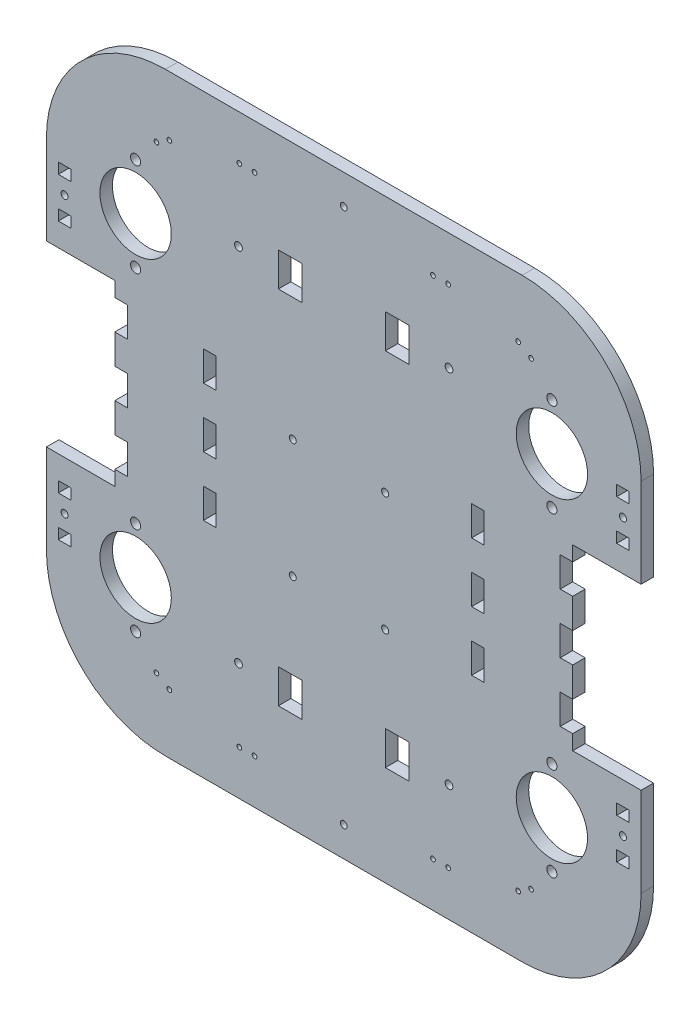
from build123d import *

# Parameters (mm, degrees)
BOSS_EXTRUDE1_DEPTH = 5.334
SKETCH3_W           = 5.334
SKETCH3_H           = 12.7
CUT_EXTRUDE1_DEPTH  = 5.334
SKETCH4_R           = 1.5
CUT_EXTRUDE2_DEPTH  = 360.249845589
SKETCH5_R           = 1.651
SKETCH5_W           = 10.16
SKETCH5_H           = 14.478
CUT_EXTRUDE3_DEPTH  = 360.249845589
SKETCH6_R           = 1.5
SKETCH6_W           = 5.334
SKETCH6_H           = 4.572
CUT_EXTRUDE4_DEPTH  = 360.249845589
SKETCH7_R           = 1
SKETCH7_R_2         = 1.45
CUT_EXTRUDE5_DEPTH  = 360.249845589
SKETCH8_R           = 15.24
SKETCH8_R_2         = 2.159
CUT_EXTRUDE6_DEPTH  = 360.249845589


with BuildPart() as part:
    # Sketch1 → Boss-Extrude1 (new body)
    with BuildSketch(Plane.XY):
        with BuildLine():
            Line((50.8, 0), (203.2, 0))
            ThreePointArc((203.2, 0), (239.121024484, 14.878975516), (254, 50.8))
            Line((254, 50.8), (254, 203.2))
            ThreePointArc((254, 203.2), (239.121024484, 239.121024484), (203.2, 254))
            Line((203.2, 254), (50.8, 254))
            ThreePointArc((50.8, 254), (14.878975516, 239.121024484), (0, 203.2))
            Line((0, 203.2), (0, 50.8))
            ThreePointArc((0, 50.8), (14.878975516, 14.878975516), (50.8, 0))
        make_face()
    extrude(amount=BOSS_EXTRUDE1_DEPTH)

    # Sketch3 → Cut-Extrude1 (cut)
    with BuildSketch(Plane.XY.offset(5.334)):
        Polygon((29.21, 95.25), (29.21, 88.9), (0, 88.9), (0, 165.1), (29.21, 165.1), (29.21, 158.75), (34.544, 158.75), (34.544, 146.05), (29.21, 146.05), (29.21, 133.35), (34.544, 133.35), (34.544, 120.65), (29.21, 120.65), (29.21, 107.95), (34.544, 107.95), (34.544, 95.25), align=None)
        Polygon((224.79, 133.35), (219.456, 133.35), (219.456, 120.65), (224.79, 120.65), (224.79, 107.95), (219.456, 107.95), (219.456, 95.25), (224.79, 95.25), (224.79, 88.9), (254, 88.9), (254, 165.1), (224.79, 165.1), (224.79, 158.75), (219.456, 158.75), (219.456, 146.05), (224.79, 146.05), align=None)
        with Locations((69.723, 127)):
            Rectangle(SKETCH3_W, SKETCH3_H)
        with Locations((69.723, 152.4)):
            Rectangle(SKETCH3_W, SKETCH3_H)
        with Locations((69.723, 101.6)):
            Rectangle(SKETCH3_W, SKETCH3_H)
        with Locations((184.277, 152.4)):
            Rectangle(SKETCH3_W, SKETCH3_H)
        with Locations((184.277, 127)):
            Rectangle(SKETCH3_W, SKETCH3_H)
        with Locations((184.277, 101.6)):
            Rectangle(SKETCH3_W, SKETCH3_H)
    extrude(amount=-CUT_EXTRUDE1_DEPTH, mode=Mode.SUBTRACT)

    # Sketch4 → Cut-Extrude2 (cut, through all)
    with BuildSketch(Plane.XY.offset(5.334)):
        with Locations((105.213395979, 93.678)):
            Circle(SKETCH4_R)
        with Locations(Location((144.679395979, 93.678, 0), (0, 0, 180))):
            Circle(SKETCH4_R)
        with Locations((144.679395979, 144.32)):
            Circle(SKETCH4_R)
        with Locations(Location((105.213395979, 144.32, 0), (0, 0, 180))):
            Circle(SKETCH4_R)
    extrude(amount=-CUT_EXTRUDE2_DEPTH, mode=Mode.SUBTRACT)

    # Sketch5 → Cut-Extrude3 (cut, through all)
    with BuildSketch(Plane.XY.offset(5.334)):
        with Locations((82.042, 204.089)):
            Circle(SKETCH5_R)
        with Locations((104.14, 204.089)):
            Rectangle(SKETCH5_W, SKETCH5_H)
        with Locations((149.86, 204.089)):
            Rectangle(SKETCH5_W, SKETCH5_H)
        with Locations((171.958, 204.089)):
            Circle(SKETCH5_R)
        with Locations((82.042, 49.911)):
            Circle(SKETCH5_R)
        with Locations((104.14, 49.911)):
            Rectangle(SKETCH5_W, SKETCH5_H)
        with Locations((149.86, 49.911)):
            Rectangle(SKETCH5_W, SKETCH5_H)
        with Locations(Location((171.958, 49.911, 0), (0, 0, 180))):
            Circle(SKETCH5_R)
    extrude(amount=-CUT_EXTRUDE3_DEPTH, mode=Mode.SUBTRACT)

    # Sketch6 → Cut-Extrude4 (cut, through all)
    with BuildSketch(Plane.XY.offset(5.334)):
        with Locations((7.747, 185.928)):
            Circle(SKETCH6_R)
        with Locations(Location((246.253, 185.928, 0), (0, 0, 180))):
            Circle(SKETCH6_R)
        with Locations((246.253, 68.072)):
            Circle(SKETCH6_R)
        with Locations(Location((7.747, 68.072, 0), (0, 0, 180))):
            Circle(SKETCH6_R)
        with Locations((7.747, 194.564)):
            Rectangle(SKETCH6_W, SKETCH6_H)
        with Locations((7.747, 177.292)):
            Rectangle(SKETCH6_W, SKETCH6_H)
        with Locations((246.253, 177.292)):
            Rectangle(SKETCH6_W, SKETCH6_H)
        with Locations((246.253, 194.564)):
            Rectangle(SKETCH6_W, SKETCH6_H)
        with Locations((246.253, 59.436)):
            Rectangle(SKETCH6_W, SKETCH6_H)
        with Locations((246.253, 76.708)):
            Rectangle(SKETCH6_W, SKETCH6_H)
        with Locations((7.747, 76.708)):
            Rectangle(SKETCH6_W, SKETCH6_H)
        with Locations((7.747, 59.436)):
            Rectangle(SKETCH6_W, SKETCH6_H)
    extrude(amount=-CUT_EXTRUDE4_DEPTH, mode=Mode.SUBTRACT)

    # Sketch7 → Cut-Extrude5 (cut, through all)
    with BuildSketch(Plane.XY.offset(5.334)):
        with Locations((82.4, 19.05)):
            Circle(SKETCH7_R)
        with Locations((88.9, 19.05)):
            Circle(SKETCH7_R)
        with Locations(Location((165.1, 19.05, 0), (0, 0, 180))):
            Circle(SKETCH7_R)
        with Locations(Location((171.6, 19.05, 0), (0, 0, 180))):
            Circle(SKETCH7_R)
        with Locations((171.6, 234.95)):
            Circle(SKETCH7_R)
        with Locations((165.1, 234.95)):
            Circle(SKETCH7_R)
        with Locations(Location((88.9, 234.95, 0), (0, 0, 180))):
            Circle(SKETCH7_R)
        with Locations(Location((82.4, 234.95, 0), (0, 0, 180))):
            Circle(SKETCH7_R)
        with Locations((127, 12.7)):
            Circle(SKETCH7_R_2)
        with Locations(Location((127, 241.3, 0), (0, 0, 180))):
            Circle(SKETCH7_R_2)
        with Locations((52.518273092, 25.4)):
            Circle(SKETCH7_R)
        with Locations((46.99, 28.818800465)):
            Circle(SKETCH7_R)
        with Locations(Location((207.01, 28.818800465, 0), (0, 0, 180))):
            Circle(SKETCH7_R)
        with Locations(Location((201.481726908, 25.4, 0), (0, 0, 180))):
            Circle(SKETCH7_R)
        with Locations((201.481726908, 228.6)):
            Circle(SKETCH7_R)
        with Locations((207.01, 225.181199535)):
            Circle(SKETCH7_R)
        with Locations(Location((46.99, 225.181199535, 0), (0, 0, 180))):
            Circle(SKETCH7_R)
        with Locations(Location((52.518273092, 228.6, 0), (0, 0, 180))):
            Circle(SKETCH7_R)
    extrude(amount=-CUT_EXTRUDE5_DEPTH, mode=Mode.SUBTRACT)

    # Sketch8 → Cut-Extrude6 (cut, through all)
    with BuildSketch(Plane.XY.offset(5.334)):
        with Locations((38.1, 59.69)):
            Circle(SKETCH8_R)
        with Locations((38.1, 39.751)):
            Circle(SKETCH8_R_2)
        with Locations((38.1, 79.629)):
            Circle(SKETCH8_R_2)
        with Locations(Location((215.9, 79.629, 0), (0, 0, 180))):
            Circle(SKETCH8_R_2)
        with Locations(Location((215.9, 39.751, 0), (0, 0, 180))):
            Circle(SKETCH8_R_2)
        with Locations(Location((215.9, 59.69, 0), (0, 0, 180))):
            Circle(SKETCH8_R)
        with Locations((215.9, 194.31)):
            Circle(SKETCH8_R)
        with Locations((215.9, 214.249)):
            Circle(SKETCH8_R_2)
        with Locations((215.9, 174.371)):
            Circle(SKETCH8_R_2)
        with Locations(Location((38.1, 174.371, 0), (0, 0, 180))):
            Circle(SKETCH8_R_2)
        with Locations(Location((38.1, 214.249, 0), (0, 0, 180))):
            Circle(SKETCH8_R_2)
        with Locations(Location((38.1, 194.31, 0), (0, 0, 180))):
            Circle(SKETCH8_R)
    extrude(amount=-CUT_EXTRUDE6_DEPTH, mode=Mode.SUBTRACT)


solid = part.part
